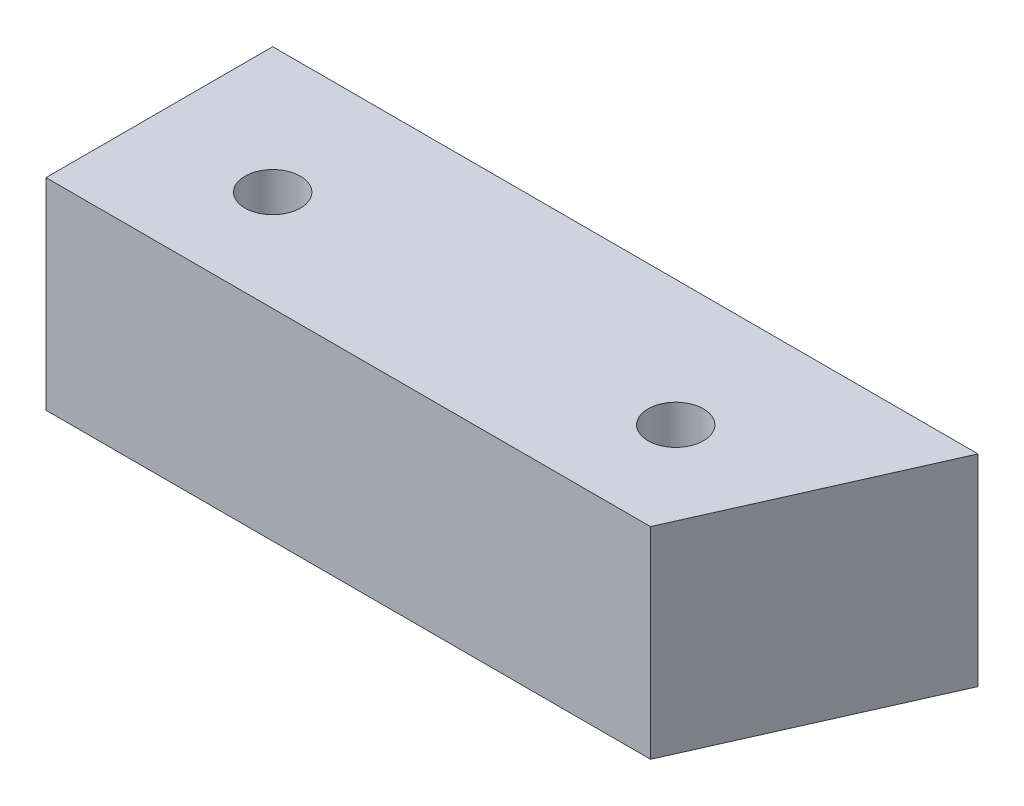
from build123d import *

# Parameters (mm, degrees)
SKETCH1_W           = 140
SKETCH1_H           = 40
BOSS_EXTRUDE1_DEPTH = 45
SKETCH2_R           = 5.5
CUT_EXTRUDE1_DEPTH  = 153.397506541
SKETCH3_R           = 2.5
CUT_EXTRUDE2_DEPTH  = 20


with BuildPart() as part:
    # Sketch1 → Boss-Extrude1 (new body)
    with BuildSketch(Plane.XY):
        with Locations((70, 20)):
            Rectangle(SKETCH1_W, SKETCH1_H)
    extrude(amount=BOSS_EXTRUDE1_DEPTH)

    # Sketch2 → Cut-Extrude1 (cut, through all)
    with BuildSketch(Plane.XZ):
        with Locations(Location((25, 25, 0), (0, 0, 270))):
            Circle(SKETCH2_R)
        with Locations(Location((105, 25, 0), (0, 0, 270))):
            Circle(SKETCH2_R)
        Polygon((120, 45), (140, 45), (140, 0), align=None)
    extrude(amount=-CUT_EXTRUDE1_DEPTH, mode=Mode.SUBTRACT)

    # Sketch3 → Cut-Extrude2 (cut)
    with BuildSketch(Plane(origin=(0, 0, 0), x_dir=(-1, 0, 0), z_dir=(0, 0, -1))):
        with Locations((-40, 25)):
            Circle(SKETCH3_R)
        with Locations((-100, 25)):
            Circle(SKETCH3_R)
        with Locations((-40, 15)):
            Circle(SKETCH3_R)
        with Locations((-100, 15)):
            Circle(SKETCH3_R)
    extrude(amount=-CUT_EXTRUDE2_DEPTH, mode=Mode.SUBTRACT)


solid = part.part
